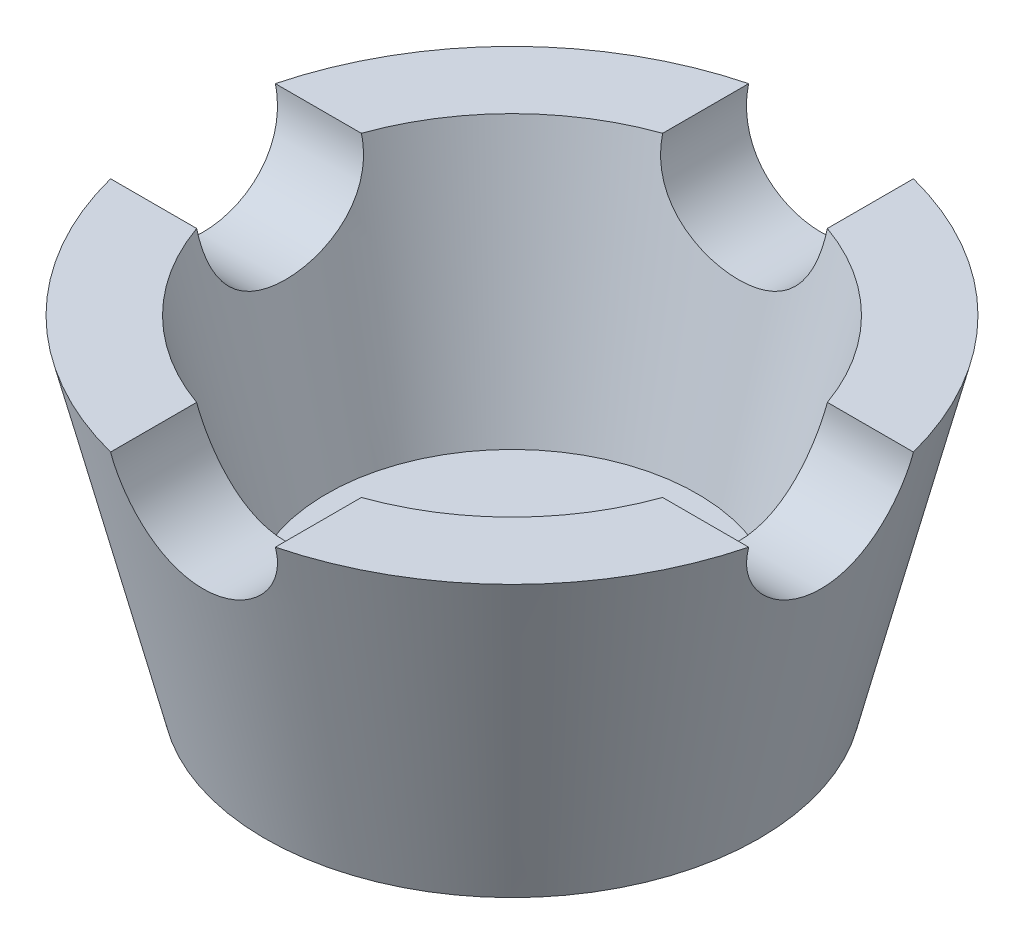
from build123d import *

# Parameters (mm, degrees)
SKETCH2_R               = 25
CUT_EXTRUDE2_DEPTH      = 30
CUT_EXTRUDE3_DEPTH      = 174.205080757
CUT_EXTRUDE3_DEPTH_BACK = 174.205080757
SKETCH3_R               = 25
SKETCH4_R               = 25
CUT_EXTRUDE4_DEPTH      = 100


with BuildPart() as part:
    # Sketch1 → Revolve1 (revolve)
    with BuildSketch(Plane.XY):
        Polygon((0, 0), (75, 0), (100, 100), (75, 100), (56.25, 25), (0, 25), align=None)
    revolve(axis=Axis((0, 0, 0), (0, 1, 0)))

    # Sketch2 → Cut-Extrude2 (cut)
    with BuildSketch(Plane(origin=(0, 25, 0), x_dir=(1, 0, 0), z_dir=(0, 1, 0))):
        with Locations(Location((0, 0, 0), (0, 0, 180))):
            Circle(SKETCH2_R)
    extrude(amount=-CUT_EXTRUDE2_DEPTH, mode=Mode.SUBTRACT)

    # Sketch3 → Cut-Extrude3 (cut, two sides: drawn at the far end of the back side and taken through both)
    with BuildSketch(Plane(origin=(0, 0, 0), x_dir=(0, 0, -1), z_dir=(1, 0, 0)).offset(-CUT_EXTRUDE3_DEPTH_BACK)):
        with Locations((0, 100)):
            Circle(SKETCH3_R)
    extrude(amount=CUT_EXTRUDE3_DEPTH + CUT_EXTRUDE3_DEPTH_BACK, mode=Mode.SUBTRACT)

    # Sketch4 → Cut-Extrude4 (cut, symmetric)
    with BuildSketch(Plane.XY):
        with Locations((0, 100)):
            Circle(SKETCH4_R)
    extrude(amount=CUT_EXTRUDE4_DEPTH, both=True, mode=Mode.SUBTRACT)


solid = part.part
